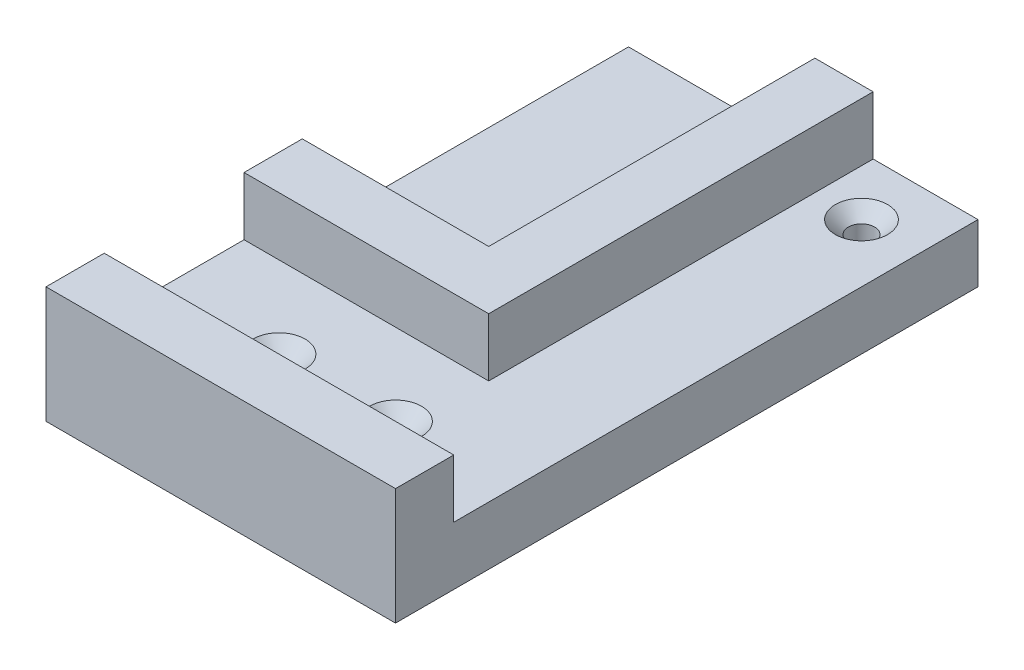
from build123d import *

# Parameters (mm, degrees)
SKETCH1_W                     = 60
SKETCH1_H                     = 100
BOSS_EXTRUDE1_DEPTH           = 20
SKETCH2_W                     = 32
SKETCH2_H                     = 56
CUT_EXTRUDE1_DEPTH            = 14.325
CUT_EXTRUDE2_DEPTH            = 10
CSK_FOR_M4_SFHCS1_D           = 4.5
CSK_FOR_M4_SFHCS1_CSINK_D     = 8.96
CSK_FOR_M4_SFHCS1_CSINK_ANGLE = 90


with BuildPart() as part:
    # Sketch1 → Boss-Extrude1 (new body)
    with BuildSketch(Plane(origin=(0, 0, 0), x_dir=(1, 0, 0), z_dir=(0, 1, 0))):
        Rectangle(SKETCH1_W, SKETCH1_H)
    extrude(amount=BOSS_EXTRUDE1_DEPTH)

    # Sketch2 → Cut-Extrude1 (cut)
    with BuildSketch(Plane(origin=(0, 20, 0), x_dir=(1, 0, 0), z_dir=(0, 1, 0))):
        with Locations((-14, 22)):
            Rectangle(SKETCH2_W, SKETCH2_H)
    extrude(amount=-CUT_EXTRUDE1_DEPTH, mode=Mode.SUBTRACT)

    # Sketch3 → Cut-Extrude2 (cut)
    with BuildSketch(Plane(origin=(0, 20, 0), x_dir=(1, 0, 0), z_dir=(0, 1, 0))):
        Polygon((30, 50), (12, 50), (12, -16), (-30, -16), (-30, -40), (30, -40), align=None)
    extrude(amount=-CUT_EXTRUDE2_DEPTH, mode=Mode.SUBTRACT)

    # CSK for M4 SFHCS1 (through all)
    with Locations(Plane(origin=(0, 10, 0), x_dir=(1, 0, 0), z_dir=(0, 1, 0))):
        with Locations((20, 40), (10, -30), (-10, -30)):
            CounterSinkHole(CSK_FOR_M4_SFHCS1_D / 2, CSK_FOR_M4_SFHCS1_CSINK_D / 2, counter_sink_angle=CSK_FOR_M4_SFHCS1_CSINK_ANGLE)


solid = part.part
